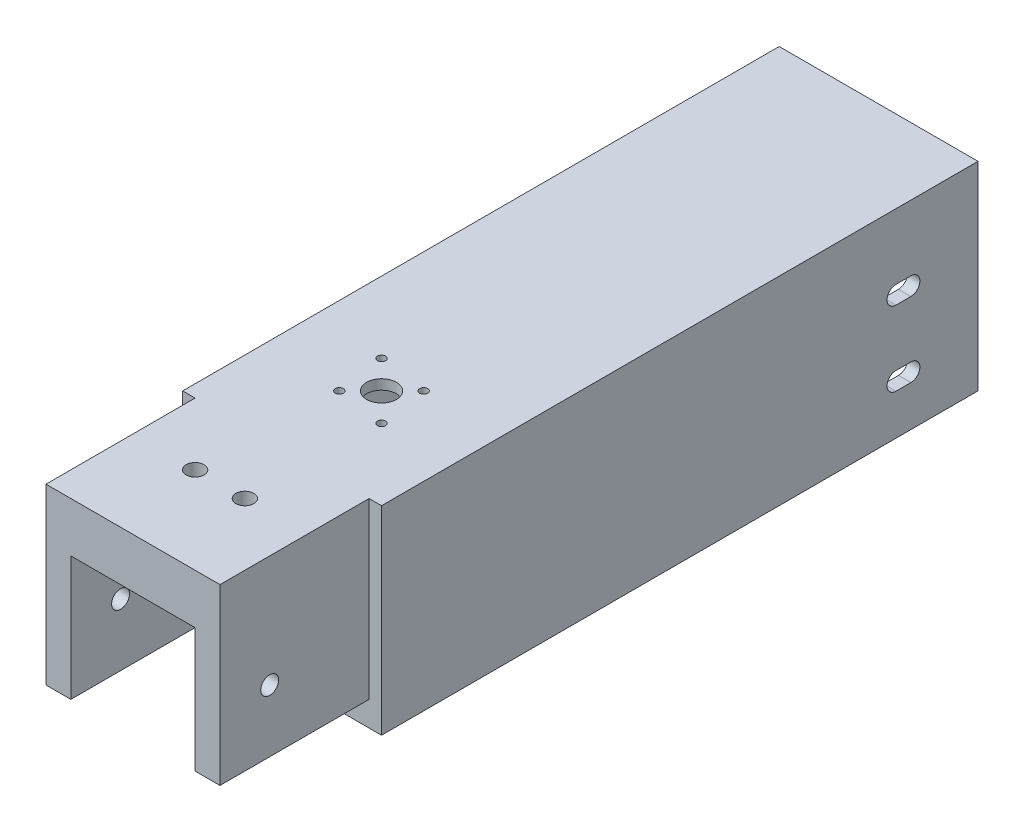
from build123d import *

# Parameters (mm, degrees)
SKETCH1_W                = 40
SKETCH1_H                = 40
SKETCH1_R                = 2.375
BOSS_EXTRUDE1_DEPTH      = 40
CUT_EXTRUDE1_DEPTH       = 61
CUT_EXTRUDE1_DEPTH_BACK  = 61
CUT_EXTRUDE2_DEPTH       = 49.989795019
CUT_EXTRUDE2_DEPTH_BACK  = 35
SKETCH6_W                = 30
SKETCH6_H                = 35
SKETCH3_R                = 3
CUT_EXTRUDE3_DEPTH       = 61
BOSS_EXTRUDE2_DEPTH      = 30
SKETCH8_R                = 1.8
CUT_EXTRUDE4_DEPTH       = 68.082039325
BOSS_EXTRUDE4_START      = -35
SKETCH10_W               = 5
SKETCH10_H               = 35
BOSS_EXTRUDE4_DEPTH      = 115
SKETCH11_R               = 2.375
CUT_EXTRUDE5_DEPTH       = 70
CUT_EXTRUDE6_DEPTH       = 115.891252931
CUT_EXTRUDE6_DEPTH_BACK  = 115.891252931
SKETCH14_W               = 30
SKETCH14_H               = 3
BOSS_EXTRUDE10_DEPTH     = 35
CUT_EXTRUDE7_DEPTH       = 108.819293264
CUT_EXTRUDE7_DEPTH_BACK  = 1.5
SKETCH16_W               = 30
SKETCH16_H               = 34
CUT_EXTRUDE8_DEPTH       = 32
CUT_EXTRUDE8_DEPTH_BACK  = 32.5
CUT_EXTRUDE9_DEPTH       = 115.04494728
CUT_EXTRUDE9_DEPTH_BACK  = 115.04494728
SKETCH19_R               = 1.8
SKETCH3_2_R              = 3
BOSS_EXTRUDE11_DEPTH     = 5
SKETCH20_W               = 30
SKETCH20_H               = 35
CUT_EXTRUDE10_DEPTH      = 10
CUT_EXTRUDE11_DEPTH      = 110.544511501
CUT_EXTRUDE11_DEPTH_BACK = 110.544511501
SKETCH22_R               = 3
SKETCH21_R               = 2.375
BOSS_EXTRUDE13_DEPTH     = 3.5
CUT_EXTRUDE12_DEPTH      = 110.544511501
CUT_EXTRUDE12_DEPTH_BACK = 110.544511501
SKETCH23_R               = 0.815
CUT_EXTRUDE13_DEPTH      = 109.315511355
CUT_EXTRUDE13_DEPTH_BACK = 1.5
SKETCH24_R               = 12.5
CUT_EXTRUDE14_DEPTH      = 17.5
CUT_EXTRUDE14_DEPTH_BACK = 17.5


with BuildPart() as part:
    # Sketch1 → Boss-Extrude1 (new body)
    with BuildSketch(Plane(origin=(0, 0, 0), x_dir=(1, 0, 0), z_dir=(0, 1, 0))):
        Rectangle(SKETCH1_W, SKETCH1_H)
        with Locations(Location((6.88, 0, 0), (0, 0, 270))):
            Circle(SKETCH1_R, mode=Mode.SUBTRACT)
        with Locations(Location((-0.009652089, -6.889652089, 0), (0, 0, 270))):
            Circle(SKETCH1_R, mode=Mode.SUBTRACT)
        with Locations(Location((-6.899304178, 0, 0), (0, 0, 270))):
            Circle(SKETCH1_R, mode=Mode.SUBTRACT)
        with Locations(Location((-0.009652089, 6.889652089, 0), (0, 0, 270))):
            Circle(SKETCH1_R, mode=Mode.SUBTRACT)
    extrude(amount=BOSS_EXTRUDE1_DEPTH)

    # Sketch4 → Cut-Extrude1 (cut, two sides: drawn at the far end of the back side and taken through both)
    with BuildSketch(Plane.ZY.offset(20).offset(-CUT_EXTRUDE1_DEPTH_BACK)):
        with BuildLine():
            Line((-20, 35), (-20, 0))
            Line((-20, 0), (15, 0))
            ThreePointArc((15, 0), (4.748737342, 24.748737342), (-20, 35))
        make_face()
    extrude(amount=CUT_EXTRUDE1_DEPTH + CUT_EXTRUDE1_DEPTH_BACK, mode=Mode.SUBTRACT)

    # Sketch6 → Cut-Extrude2 (cut, two sides: drawn at the far end of the back side and taken through both)
    with BuildSketch(Plane.XZ.offset(-CUT_EXTRUDE2_DEPTH_BACK)):
        with Locations((0, -2.5)):
            Rectangle(SKETCH6_W, SKETCH6_H)
    extrude(amount=CUT_EXTRUDE2_DEPTH + CUT_EXTRUDE2_DEPTH_BACK, mode=Mode.SUBTRACT)

    # Sketch3 → Cut-Extrude3 (cut, through all)
    with BuildSketch(Plane.XY.offset(20)):
        with Locations((0, 13)):
            Circle(SKETCH3_R)
        with Locations((-7, 20)):
            Circle(SKETCH3_R)
        with Locations((7, 20)):
            Circle(SKETCH3_R)
    extrude(amount=-CUT_EXTRUDE3_DEPTH, mode=Mode.SUBTRACT)

    # Sketch7 → Boss-Extrude2 (add)
    with BuildSketch(Plane.XY.offset(20)):
        Polygon((-17.5, 40), (17.5, 40), (17.5, 5), (12.5, 5), (12.5, 30), (-12.5, 30), (-12.5, 5), (-17.5, 5), (-17.5, 23.79079138), align=None)
    extrude(amount=BOSS_EXTRUDE2_DEPTH)

    # Sketch8 → Cut-Extrude4 (cut, through all)
    with BuildSketch(Plane(origin=(0, 40, 0), x_dir=(1, 0, 0), z_dir=(0, 1, 0))):
        with Locations(Location((5, -32.5, 0), (0, 0, 270))):
            Circle(SKETCH8_R)
        with Locations(Location((-5, -32.5, 0), (0, 0, 270))):
            Circle(SKETCH8_R)
    extrude(amount=-CUT_EXTRUDE4_DEPTH, mode=Mode.SUBTRACT)

    # Sketch10 → Boss-Extrude4 (add)
    with BuildSketch(Plane(origin=(0, 0, -20), x_dir=(-1, 0, 0), z_dir=(0, 0, -1)).offset(BOSS_EXTRUDE4_START)):
        Polygon((20, 40), (-20, 40), (-20, 35), (-15, 35), (15, 35), (20, 35), align=None)
        with Locations((17.5, 17.5)):
            Rectangle(SKETCH10_W, SKETCH10_H)
        with Locations((-17.5, 17.5)):
            Rectangle(SKETCH10_W, SKETCH10_H)
    extrude(amount=BOSS_EXTRUDE4_DEPTH)

    # Sketch11 → Cut-Extrude5 (cut)
    with BuildSketch(Plane(origin=(0, 40, 0), x_dir=(1, 0, 0), z_dir=(0, 1, 0))):
        with Locations(Location((-0.009652089, -6.889652089, 0), (0, 0, 270))):
            Circle(SKETCH11_R)
        with Locations(Location((6.88, 0, 0), (0, 0, 270))):
            Circle(SKETCH11_R)
        with Locations(Location((-0.009652089, 6.889652089, 0), (0, 0, 270))):
            Circle(SKETCH11_R)
        with Locations(Location((-6.899304178, 0, 0), (0, 0, 270))):
            Circle(SKETCH11_R)
    extrude(amount=-CUT_EXTRUDE5_DEPTH, mode=Mode.SUBTRACT)

    # Sketch13 → Cut-Extrude6 (cut, two sides: drawn at the far end of the back side and taken through both)
    with BuildSketch(Plane.ZY.offset(20).offset(-CUT_EXTRUDE6_DEPTH_BACK)):
        with BuildLine():
            Line((-86.5, 26.8), (-83.5, 26.8))
            ThreePointArc((-83.5, 26.8), (-81.7, 25), (-83.5, 23.2))
            Line((-83.5, 23.2), (-86.5, 23.2))
            ThreePointArc((-86.5, 23.2), (-88.3, 25), (-86.5, 26.8))
        make_face()
        with BuildLine():
            Line((-86.5, 8.2), (-83.5, 8.2))
            ThreePointArc((-83.5, 8.2), (-81.7, 10), (-83.5, 11.8))
            Line((-83.5, 11.8), (-86.5, 11.8))
            ThreePointArc((-86.5, 11.8), (-88.3, 10), (-86.5, 8.2))
        make_face()
    extrude(amount=CUT_EXTRUDE6_DEPTH + CUT_EXTRUDE6_DEPTH_BACK, mode=Mode.SUBTRACT)

    # Sketch14 → Boss-Extrude10 (add)
    with BuildSketch(Plane.XZ.offset(-35)):
        with Locations((0, -98.5)):
            Rectangle(SKETCH14_W, SKETCH14_H)
        with Locations((0, -45.5)):
            Rectangle(SKETCH14_W, SKETCH14_H)
        with Locations((0, -20.5)):
            Rectangle(SKETCH14_W, SKETCH14_H)
        with Locations((0, -68.5)):
            Rectangle(SKETCH14_W, SKETCH14_H)
    extrude(amount=BOSS_EXTRUDE10_DEPTH)

    # Sketch16 → Cut-Extrude7 (cut, two sides: drawn at the far end of the back side and taken through both)
    with BuildSketch(Plane.XZ.offset(-35).offset(-CUT_EXTRUDE7_DEPTH_BACK)):
        with Locations((0, -2)):
            Rectangle(SKETCH16_W, SKETCH16_H)
    extrude(amount=CUT_EXTRUDE7_DEPTH + CUT_EXTRUDE7_DEPTH_BACK, mode=Mode.SUBTRACT)

    # Sketch17 → Cut-Extrude8 (cut, two sides: drawn at the far end of the back side and taken through both)
    with BuildSketch(Plane(origin=(0, 0, -47), x_dir=(-1, 0, 0), z_dir=(0, 0, -1)).offset(-CUT_EXTRUDE8_DEPTH_BACK)):
        with BuildLine():
            Line((-15, -8.523755025), (-15, 5.476244975))
            ThreePointArc((-15, 5.476244975), (0, 20.476244975), (15, 5.476244975))
            Line((15, 5.476244975), (15, -8.523755025))
            ThreePointArc((15, -8.523755025), (0, -23.523755025), (-15, -8.523755025))
        make_face()
    extrude(amount=CUT_EXTRUDE8_DEPTH + CUT_EXTRUDE8_DEPTH_BACK, mode=Mode.SUBTRACT)

    # Sketch19 → Cut-Extrude9 (cut, two sides: drawn at the far end of the back side and taken through both)
    with BuildSketch(Plane.ZY.offset(17.5).offset(-CUT_EXTRUDE9_DEPTH_BACK)):
        with Locations(Location((40, 17.5, 0), (0, 0, 270))):
            Circle(SKETCH19_R)
    extrude(amount=CUT_EXTRUDE9_DEPTH + CUT_EXTRUDE9_DEPTH_BACK, mode=Mode.SUBTRACT)

    # Sketch3<2> → Boss-Extrude11 (add)
    with BuildSketch(Plane.XY.offset(20)):
        with Locations((0, 13)):
            Circle(SKETCH3_2_R)
        with Locations((-7, 20)):
            Circle(SKETCH3_2_R)
        with Locations((7, 20)):
            Circle(SKETCH3_2_R)
    extrude(amount=-BOSS_EXTRUDE11_DEPTH)

    # Sketch20 → Cut-Extrude10 (cut)
    with BuildSketch(Plane.XY.offset(-97)):
        with Locations((0, 17.5)):
            Rectangle(SKETCH20_W, SKETCH20_H)
    extrude(amount=-CUT_EXTRUDE10_DEPTH, mode=Mode.SUBTRACT)

    # Sketch22 → Cut-Extrude11 (cut, two sides: drawn at the far end of the back side and taken through both)
    with BuildSketch(Plane(origin=(0, 40, 0), x_dir=(1, 0, 0), z_dir=(0, 1, 0)).offset(-CUT_EXTRUDE11_DEPTH_BACK)):
        with Locations(Location((0, 0, 0), (0, 0, 270))):
            Circle(SKETCH22_R)
    extrude(amount=CUT_EXTRUDE11_DEPTH + CUT_EXTRUDE11_DEPTH_BACK, mode=Mode.SUBTRACT)

    # Sketch21 → Boss-Extrude13 (add)
    with BuildSketch(Plane(origin=(0, 40, 0), x_dir=(1, 0, 0), z_dir=(0, 1, 0))):
        with Locations((-0.009652089, -6.889652089)):
            Circle(SKETCH21_R)
        with Locations((6.88, 0)):
            Circle(SKETCH21_R)
        with Locations((-0.009652089, 6.889652089)):
            Circle(SKETCH21_R)
        with Locations((-6.899304178, 0)):
            Circle(SKETCH21_R)
    extrude(amount=-BOSS_EXTRUDE13_DEPTH)

    # Sketch23 → Cut-Extrude12 (cut, two sides: drawn at the far end of the back side and taken through both)
    with BuildSketch(Plane(origin=(0, 40, 0), x_dir=(1, 0, 0), z_dir=(0, 1, 0)).offset(-CUT_EXTRUDE12_DEPTH_BACK)):
        with Locations(Location((-5.656854249, 5.656854249, 0), (0, 0, 270))):
            Circle(SKETCH23_R)
        with Locations(Location((4.242640687, 4.242640687, 0), (0, 0, 270))):
            Circle(SKETCH23_R)
        with Locations(Location((5.656854249, -5.656854249, 0), (0, 0, 270))):
            Circle(SKETCH23_R)
        with Locations(Location((-4.242640687, -4.242640687, 0), (0, 0, 270))):
            Circle(SKETCH23_R)
    extrude(amount=CUT_EXTRUDE12_DEPTH + CUT_EXTRUDE12_DEPTH_BACK, mode=Mode.SUBTRACT)

    # Sketch24 → Cut-Extrude13 (cut, two sides: drawn at the far end of the back side and taken through both)
    with BuildSketch(Plane.XZ.offset(-36.5).offset(-CUT_EXTRUDE13_DEPTH_BACK)):
        with Locations(Location((0, 0, 0), (0, 0, 90))):
            Circle(SKETCH24_R)
    extrude(amount=CUT_EXTRUDE13_DEPTH + CUT_EXTRUDE13_DEPTH_BACK, mode=Mode.SUBTRACT)

    # Sketch25 → Cut-Extrude14 (cut, two sides: drawn at the far end of the back side and taken through both)
    with BuildSketch(Plane(origin=(0, 0, 0), x_dir=(0, 0, -1), z_dir=(1, 0, 0)).offset(-CUT_EXTRUDE14_DEPTH_BACK)):
        with BuildLine():
            Line((92.5, 25), (92.5, -7.922367103))
            ThreePointArc((92.5, -7.922367103), (85, -15.422367103), (77.5, -7.922367103))
            Line((77.5, -7.922367103), (77.5, 25))
            ThreePointArc((77.5, 25), (85, 32.5), (92.5, 25))
        make_face()
    extrude(amount=CUT_EXTRUDE14_DEPTH + CUT_EXTRUDE14_DEPTH_BACK, mode=Mode.SUBTRACT)


solid = part.part
